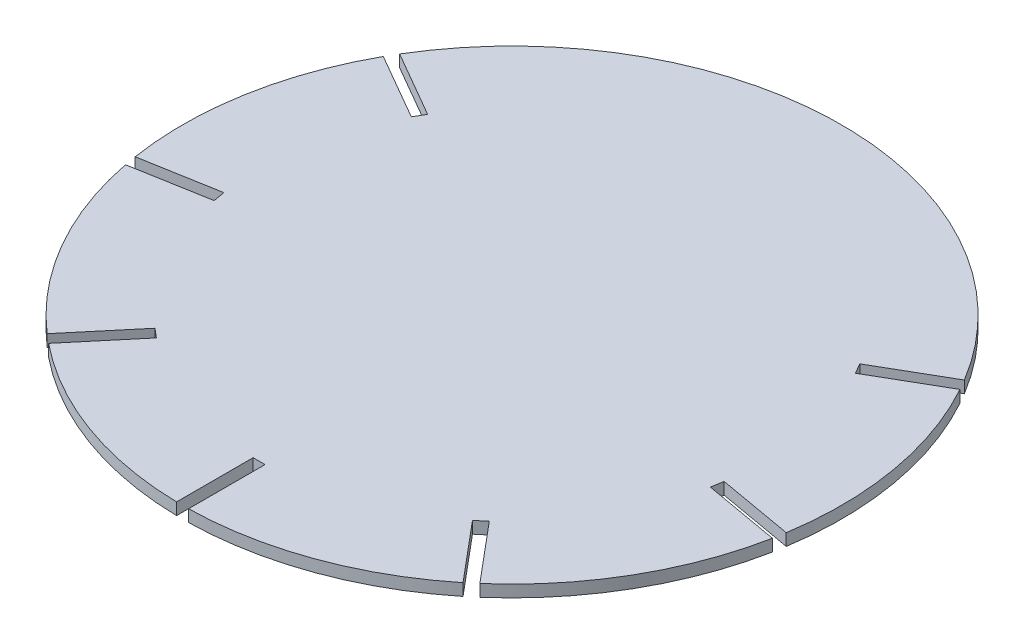
from build123d import *

# Parameters (mm, degrees)
SKETCH1_R           = 185
BOSS_EXTRUDE1_DEPTH = 6.7
SKETCH2_W           = 6.7
SKETCH2_H           = 44
CUT_EXTRUDE3_DEPTH  = 6.7


with BuildPart() as part:
    # Sketch1 → Boss-Extrude1 (new body)
    with BuildSketch(Plane(origin=(0, 0, 0), x_dir=(1, 0, 0), z_dir=(0, 1, 0))):
        with Locations(Location((0, 0, 0), (0, 0, 270))):
            Circle(SKETCH1_R)
    extrude(amount=BOSS_EXTRUDE1_DEPTH)

    # Sketch2 → Cut-Extrude3 (cut)
    with BuildSketch(Plane(origin=(0, 6.7, 0), x_dir=(1, 0, 0), z_dir=(0, 1, 0))):
        Polygon((159.405725104, 95.901185103), (121.300607337, 73.901185103), (124.650607337, 68.098814897), (162.755725104, 90.098814897), align=None)
        Polygon((122.124744286, -140.330927928), (93.84208946, -106.62497243), (88.709591691, -110.931649415), (116.992246517, -144.637604913), align=None)
        Polygon((183.755963455, -28.999455073), (140.424422323, -21.358935256), (139.260979533, -27.957147201), (182.592520665, -35.597667019), align=None)
        with Locations((0, -164)):
            Rectangle(SKETCH2_W, SKETCH2_H)
        Polygon((-116.992246517, -144.637604913), (-88.709591691, -110.931649415), (-93.84208946, -106.62497243), (-122.124744286, -140.330927928), align=None)
        Polygon((-182.592520665, -35.597667019), (-139.260979533, -27.957147201), (-140.424422323, -21.358935256), (-183.755963455, -28.999455073), align=None)
        Polygon((-162.755725104, 90.098814897), (-124.650607337, 68.098814897), (-121.300607337, 73.901185103), (-159.405725104, 95.901185103), align=None)
    extrude(amount=-CUT_EXTRUDE3_DEPTH, mode=Mode.SUBTRACT)


solid = part.part
